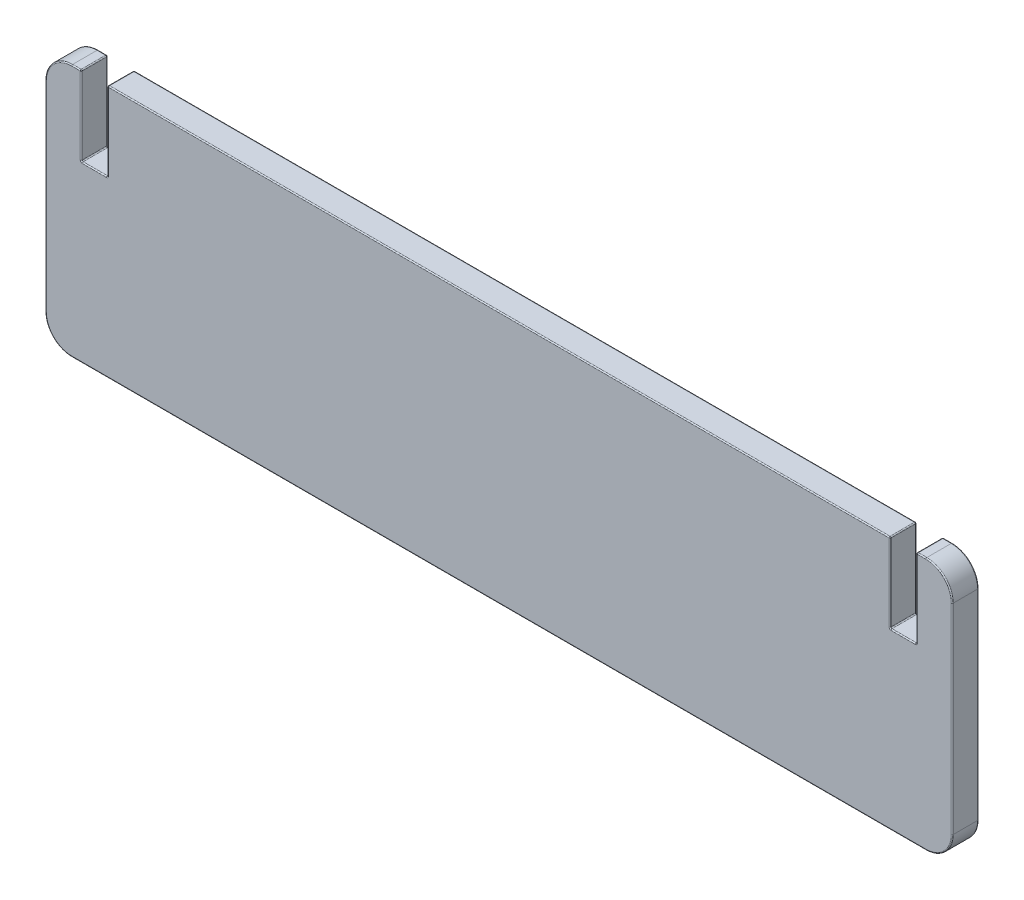
from build123d import *

# Parameters (mm, degrees)
RESSALTO_EXTRUS_O1_DEPTH = 2.5
FILETE1_R                = 0.1


with BuildPart() as part:
    # Esboço1 → Ressalto-extrusão1 (new body)
    with BuildSketch(Plane.XY):
        with BuildLine():
            ThreePointArc((0.822871292, 142.838341472), (1.555104339, 141.070574519), (3.322871292, 140.338341472))
            Line((3.322871292, 140.338341472), (84.322871292, 140.338341472))
            ThreePointArc((84.322871292, 140.338341472), (86.090638245, 141.070574519), (86.822871292, 142.838341472))
            Line((86.822871292, 142.838341472), (86.822871292, 161.838341472))
            ThreePointArc((86.822871292, 161.838341472), (86.090638245, 163.606108425), (84.322871292, 164.338341472))
            Line((84.322871292, 164.338341472), (83.422871292, 164.338341472))
            Line((83.422871292, 164.338341472), (83.422871292, 156.838341472))
            Line((83.422871292, 156.838341472), (80.922871292, 156.838341472))
            Line((80.922871292, 156.838341472), (80.922871292, 164.338341472))
            Line((80.922871292, 164.338341472), (6.722871292, 164.338341472))
            Line((6.722871292, 164.338341472), (6.722871292, 156.838341472))
            Line((6.722871292, 156.838341472), (4.222871292, 156.838341472))
            Line((4.222871292, 156.838341472), (4.222871292, 164.338341472))
            Line((4.222871292, 164.338341472), (3.322871292, 164.338341472))
            ThreePointArc((3.322871292, 164.338341472), (1.555104339, 163.606108425), (0.822871292, 161.838341472))
            Line((0.822871292, 161.838341472), (0.822871292, 142.838341472))
        make_face()
    extrude(amount=RESSALTO_EXTRUS_O1_DEPTH)

    # Filete1
    filete1_edges = [part.edges().sort_by_distance(p)[0] for p in [
        (86.090638245, 141.070574519, 2.5),
        (0.822871292, 152.338341472, 0),
        (1.555104339, 163.606108425, 0),
        (3.772871292, 164.338341472, 0),
        (86.822871292, 152.338341472, 2.5),
        (4.222871292, 160.588341472, 0),
        (5.472871292, 156.838341472, 0),
        (6.722871292, 160.588341472, 0),
        (43.822871292, 164.338341472, 0),
        (80.922871292, 160.588341472, 0),
        (82.172871292, 156.838341472, 0),
        (83.422871292, 160.588341472, 0),
        (83.872871292, 164.338341472, 0),
        (86.090638245, 163.606108425, 2.5),
        (86.090638245, 163.606108425, 0),
        (86.822871292, 152.338341472, 0),
        (86.090638245, 141.070574519, 0),
        (43.822871292, 140.338341472, 0),
        (1.555104339, 141.070574519, 0),
        (83.872871292, 164.338341472, 2.5),
        (4.222871292, 164.338341472, 1.25),
        (4.222871292, 156.838341472, 1.25),
        (83.422871292, 160.588341472, 2.5),
        (6.722871292, 156.838341472, 1.25),
        (6.722871292, 164.338341472, 1.25),
        (80.922871292, 164.338341472, 1.25),
        (80.922871292, 156.838341472, 1.25),
        (83.422871292, 156.838341472, 1.25),
        (83.422871292, 164.338341472, 1.25),
        (82.172871292, 156.838341472, 2.5),
        (80.922871292, 160.588341472, 2.5),
        (43.822871292, 164.338341472, 2.5),
        (6.722871292, 160.588341472, 2.5),
        (5.472871292, 156.838341472, 2.5),
        (1.555104339, 141.070574519, 2.5),
        (4.222871292, 160.588341472, 2.5),
        (3.772871292, 164.338341472, 2.5),
        (1.555104339, 163.606108425, 2.5),
        (0.822871292, 152.338341472, 2.5),
        (43.822871292, 140.338341472, 2.5),
    ]]
    fillet(filete1_edges, radius=FILETE1_R)


solid = part.part
